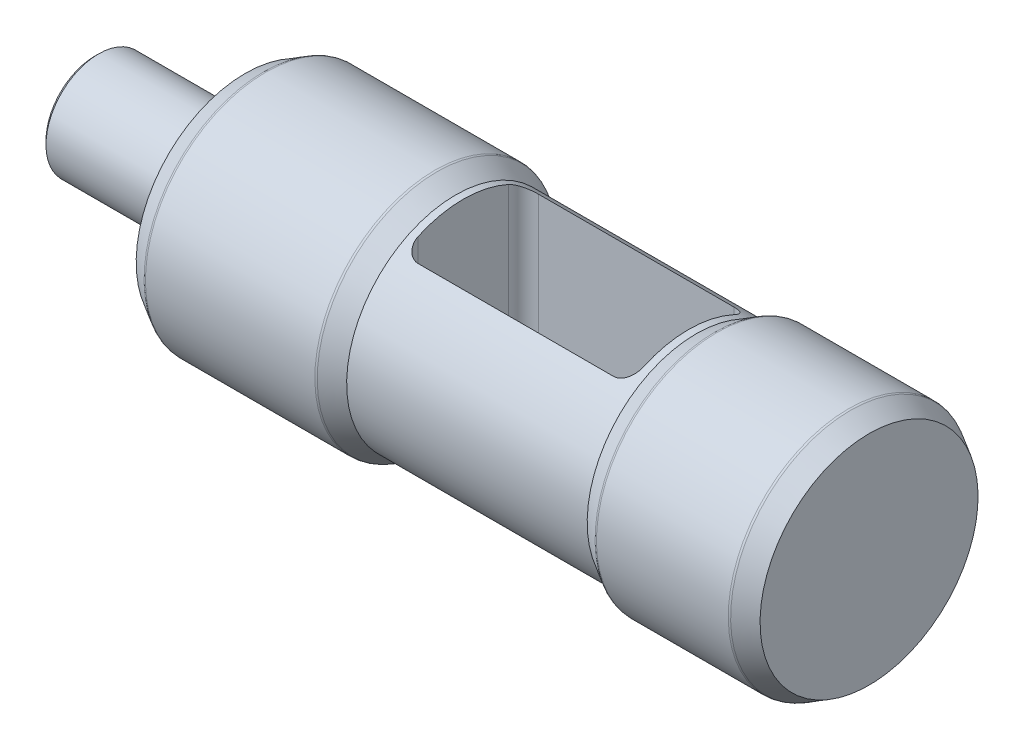
from build123d import *

# Parameters (mm, degrees)
CUT_EXTRUDE_1_DEPTH      = 106.456152041
CUT_EXTRUDE_1_DEPTH_BACK = 106.456152041


with BuildPart() as part:
    # Эскиз1 → Повернуть1 (revolve)
    with BuildSketch(Plane.XY):
        with BuildLine():
            Line((0, 0), (0, 14.5))
            Line((0, 14.5), (-2.482050808, 15.933012702))
            ThreePointArc((-2.482050808, 15.933012702), (-2.602641285, 15.982962913), (-2.732050808, 16))
            Line((-2.732050808, 16), (-20.267949192, 16))
            ThreePointArc((-20.267949192, 16), (-20.397358715, 15.982962913), (-20.517949192, 15.933012702))
            Line((-20.517949192, 15.933012702), (-23, 14.5))
            Line((-23, 14.5), (-55, 14.5))
            Line((-55, 14.5), (-57.482050808, 15.933012702))
            ThreePointArc((-57.482050808, 15.933012702), (-57.602641285, 15.982962913), (-57.732050808, 16))
            Line((-57.732050808, 16), (-80.267949192, 16))
            ThreePointArc((-80.267949192, 16), (-80.397358715, 15.982962913), (-80.517949192, 15.933012702))
            Line((-80.517949192, 15.933012702), (-83, 14.5))
            Line((-83, 14.5), (-83, 7))
            Line((-83, 7), (-102.5, 7))
            Line((-102.5, 7), (-103, 6.5))
            Line((-103, 6.5), (-103, 0))
            Line((-103, 0), (0, 0))
        make_face()
    revolve(axis=Axis((0, 0, 0), (-1, 0, 0)))

    # Эскиз2 → Вырез-Вытянуть1 (cut, two sides: drawn at the far end of the back side and taken through both)
    with BuildSketch(Plane(origin=(0, 0, 0), x_dir=(1, 0, 0), z_dir=(0, 1, 0)).offset(-CUT_EXTRUDE_1_DEPTH_BACK)):
        with BuildLine():
            Line((-52, -8), (-26, -8))
            ThreePointArc((-26, -8), (-24.585786438, -7.414213562), (-24, -6))
            Line((-24, -6), (-24, 6))
            ThreePointArc((-24, 6), (-24.585786438, 7.414213562), (-26, 8))
            Line((-26, 8), (-52, 8))
            ThreePointArc((-52, 8), (-53.414213562, 7.414213562), (-54, 6))
            Line((-54, 6), (-54, -6))
            ThreePointArc((-54, -6), (-53.414213562, -7.414213562), (-52, -8))
        make_face()
    extrude(amount=CUT_EXTRUDE_1_DEPTH + CUT_EXTRUDE_1_DEPTH_BACK, mode=Mode.SUBTRACT)


solid = part.part
